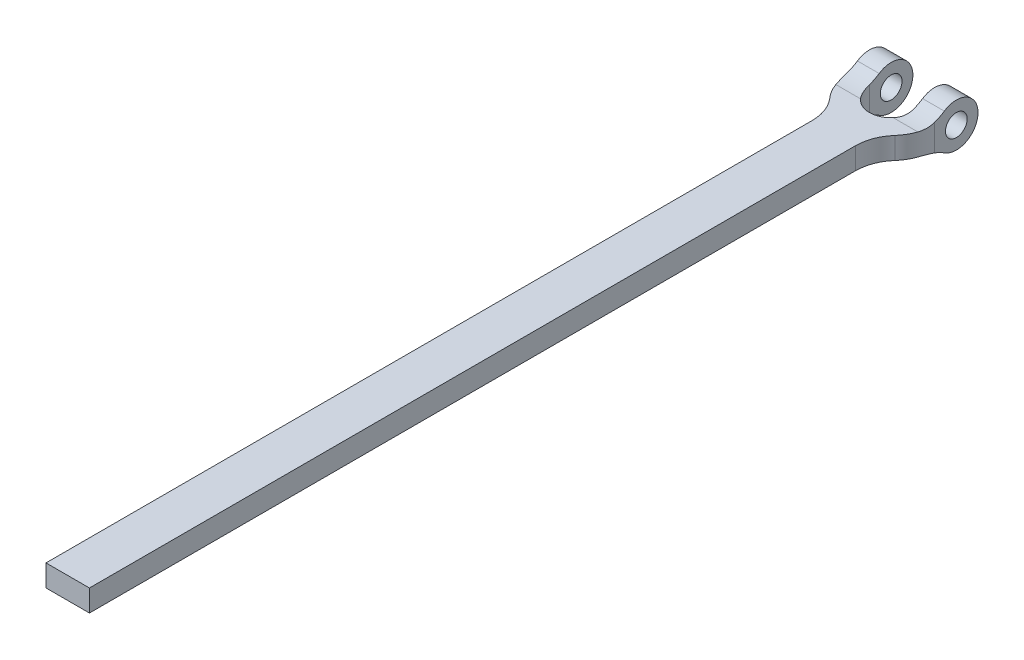
from build123d import *

# Parameters (mm, degrees)
BOSS_EXTRUDE1_DEPTH = 10
CUT_EXTRUDE5_DEPTH  = 103.46950766


with BuildPart() as part:
    # Sketch1 → Boss-Extrude1 (new body)
    with BuildSketch(Plane(origin=(0, 0, 0), x_dir=(1, 0, 0), z_dir=(0, 1, 0))):
        with BuildLine():
            ThreePointArc((5, 90), (0, 85), (-5, 90))
            Line((-5, 90), (-5, 98.660254038))
            ThreePointArc((-5, 98.660254038), (-8.660254037, 95.000000002), (-10, 90.000000004))
            ThreePointArc((-10, 90.000000004), (-9.354143468, 86.464466096), (-7.5, 83.385621722))
            ThreePointArc((-7.5, 83.385621722), (-5.645856533, 80.306777351), (-5, 76.771243445))
            Line((-5, 76.771243445), (-5, -100))
            Line((-5, -100), (5, -100))
            Line((5, -100), (5, 76.771243445))
            ThreePointArc((5, 76.771243445), (5.645856533, 80.306777351), (7.5, 83.385621722))
            ThreePointArc((7.5, 83.385621722), (9.354143466, 86.464466092), (10, 89.999999995))
            ThreePointArc((10, 89.999999995), (8.660254039, 94.999999998), (5, 98.660254038))
            Line((5, 98.660254038), (5, 90))
        make_face()
        with BuildLine():
            Line((5, 100), (5, 98.660254038))
            ThreePointArc((5, 98.660254038), (8.660254039, 94.999999998), (10, 89.999999995))
            Line((10, 89.999999995), (10, 100))
            Line((10, 100), (5, 100))
        make_face()
        with BuildLine():
            ThreePointArc((-10, 90.000000004), (-8.660254037, 95.000000002), (-5, 98.660254038))
            Line((-5, 98.660254038), (-5, 100))
            Line((-5, 100), (-10, 100))
            Line((-10, 100), (-10, 90.000000004))
        make_face()
    extrude(amount=BOSS_EXTRUDE1_DEPTH)

    # Sketch2 → Cut-Extrude5 (cut, through all)
    with BuildSketch(Plane.ZY.offset(10)):
        with BuildLine():
            ThreePointArc((-92.237664695, 9.165798128), (-91.153608851, 8.540893309), (-90, 8.056259709))
            Line((-90, 8.056259709), (-90, 10))
            Line((-90, 10), (-100, 10))
            Line((-100, 10), (-100, 0))
            Line((-100, 0), (-90, 0))
            Line((-90, 0), (-90, 1.943740291))
            ThreePointArc((-90, 1.943740291), (-91.153608851, 1.459106691), (-92.237664695, 0.834201872))
            ThreePointArc((-92.237664695, 0.834201872), (-99.998436794, 5), (-92.237664695, 9.165798128))
        make_face()
        with BuildLine():
            ThreePointArc((-90, 8.056259709), (-88.378988868, 7.640045565), (-86.711266306, 7.5))
            Line((-86.711266306, 7.5), (99.557534865, 7.5))
            Line((99.557534865, 7.5), (99.557534865, 2.5))
            Line((99.557534865, 2.5), (-86.711266306, 2.5))
            ThreePointArc((-86.711266306, 2.5), (-88.378988868, 2.359954435), (-90, 1.943740291))
            Line((-90, 1.943740291), (-90, 0))
            Line((-90, 0), (-83.385621722, 0))
            Line((-83.385621722, 0), (-76.771243445, 0))
            Line((-76.771243445, 0), (100, 0))
            Line((100, 0), (100, 10))
            Line((100, 10), (-76.771243445, 10))
            Line((-76.771243445, 10), (-83.385621722, 10))
            Line((-83.385621722, 10), (-90, 10))
            Line((-90, 10), (-90, 8.056259709))
        make_face()
        with BuildLine():
            ThreePointArc((-92.5, 5), (-93.232233047, 6.767766953), (-95, 7.5))
            Line((-95, 7.5), (-95, 2.5))
            ThreePointArc((-95, 2.5), (-93.232233047, 3.232233047), (-92.5, 5))
        make_face()
        with BuildLine():
            Line((-95, 2.5), (-95, 7.5))
            ThreePointArc((-95, 7.5), (-97.5, 5), (-95, 2.5))
        make_face()
    extrude(amount=-CUT_EXTRUDE5_DEPTH, mode=Mode.SUBTRACT)


solid = part.part
